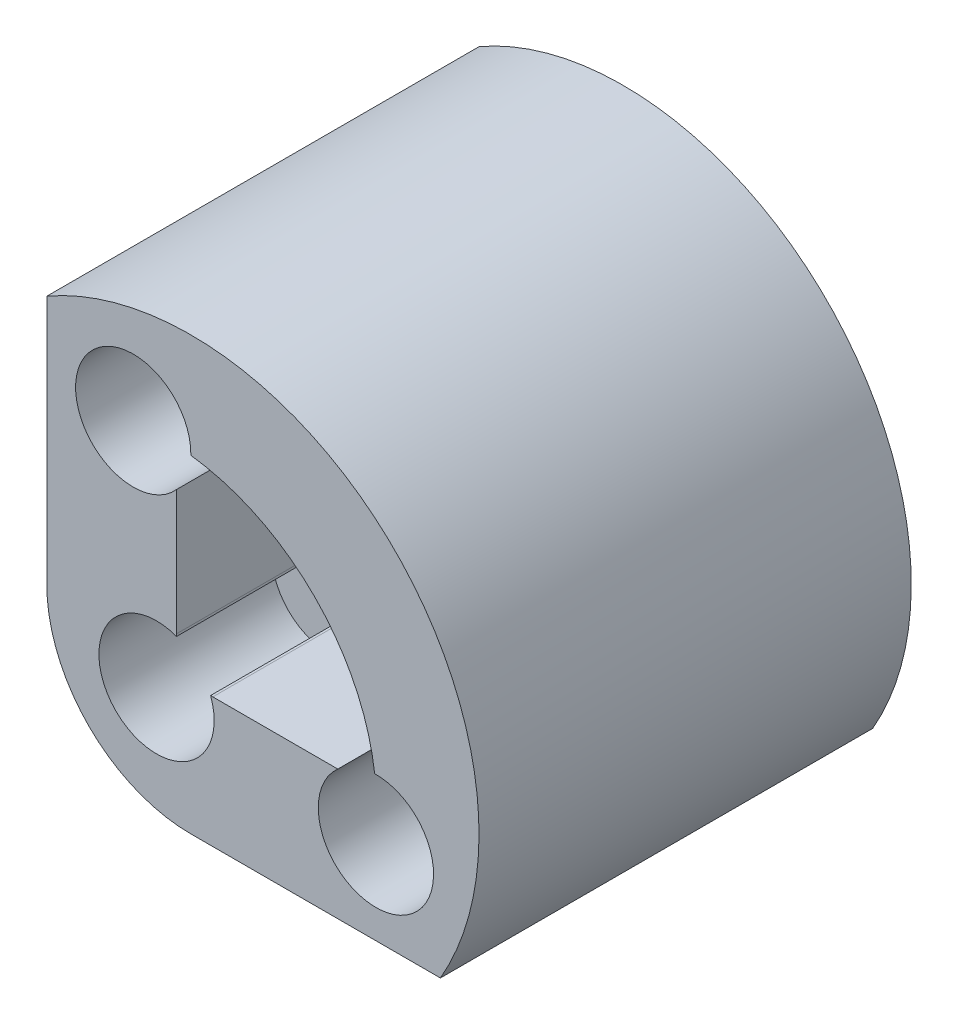
from build123d import *

# Parameters (mm, degrees)
RESSALTO_EXTRUS_O1_DEPTH = 15
CORTE_EXTRUS_O1_DEPTH    = 240
ESBO_O4_R                = 2
CORTE_EXTRUS_O3_DEPTH    = 6
CORTE_EXTRUS_O4_START    = -6
ESBO_O6_R                = 2
CORTE_EXTRUS_O4_DEPTH    = 6


with BuildPart() as part:
    # Esboço1 → Ressalto-extrusão1 (new body)
    with BuildSketch(Plane.XY):
        with BuildLine():
            Line((-7.5, 6.160254038), (-7.5, -2.5))
            ThreePointArc((-7.5, -2.5), (-6.035533906, -6.035533906), (-2.5, -7.5))
            Line((-2.5, -7.5), (6.160254038, -7.5))
            ThreePointArc((6.160254038, -7.5), (4.571067812, 4.571067812), (-7.5, 6.160254038))
        make_face()
    extrude(amount=RESSALTO_EXTRUS_O1_DEPTH)

    # Esboço2 → Corte-extrusão1 (cut)
    with BuildSketch(Plane.XY.offset(15)):
        with BuildLine():
            Line((-3, 3.922616289), (-3, -1.737383711))
            ThreePointArc((-3, -1.737383711), (-2.630188251, -2.630188251), (-1.737383711, -3))
            Line((-1.737383711, -3), (3.922616289, -3))
            ThreePointArc((3.922616289, -3), (1.78599112, 1.78599112), (-3, 3.922616289))
        make_face()
    extrude(amount=-CORTE_EXTRUS_O1_DEPTH, mode=Mode.SUBTRACT)

    # Esboço4 → Corte-extrusão3 (cut)
    with BuildSketch(Plane.XY.offset(15)):
        with Locations((-3.690848423, -3.690848423)):
            Circle(ESBO_O4_R)
        with Locations((-4.5, 3.922616289)):
            Circle(ESBO_O4_R)
        with Locations((3.922616289, -4.5)):
            Circle(ESBO_O4_R)
    extrude(amount=-CORTE_EXTRUS_O3_DEPTH, mode=Mode.SUBTRACT)

    # Esboço6 → Corte-extrusão4 (cut)
    with BuildSketch(Plane(origin=(0, 0, 0), x_dir=(-1, 0, 0), z_dir=(0, 0, -1)).offset(CORTE_EXTRUS_O4_START)):
        with Locations((4.5, 3.922616289)):
            Circle(ESBO_O6_R)
        with Locations((-3.922616289, -4.5)):
            Circle(ESBO_O6_R)
        with Locations((3.690848423, -3.690848423)):
            Circle(ESBO_O6_R)
    extrude(amount=CORTE_EXTRUS_O4_DEPTH, mode=Mode.SUBTRACT)


solid = part.part
